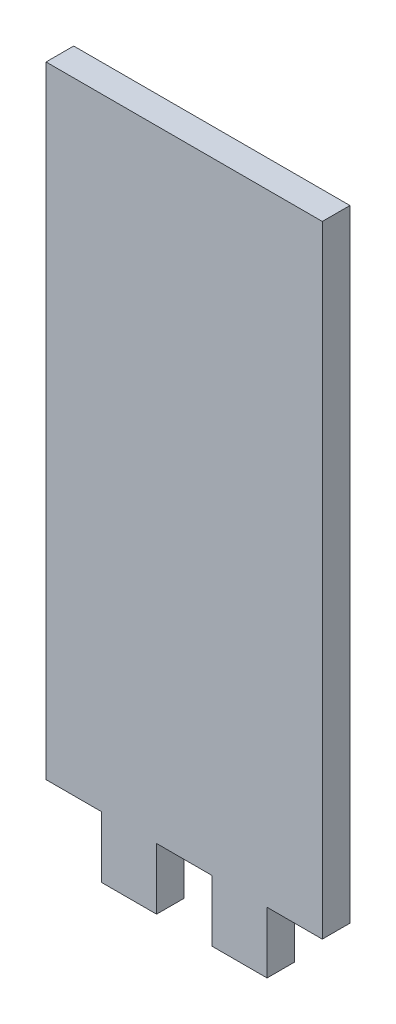
from build123d import *

# Parameters (mm, degrees)
EXTRUDE_1_DEPTH = 2


with BuildPart() as part:
    # Эскиз1 → Бобышка-Вытянуть1 (new body)
    with BuildSketch(Plane.XY):
        Polygon((10, -22.5), (6, -22.5), (6, -26.935152494), (2, -26.935152494), (2, -22.5), (-2, -22.5), (-2, -26.935152494), (-6, -26.935152494), (-6, -22.5), (-10, -22.5), (-10, 22.5), (10, 22.5), align=None)
    extrude(amount=EXTRUDE_1_DEPTH)


solid = part.part
